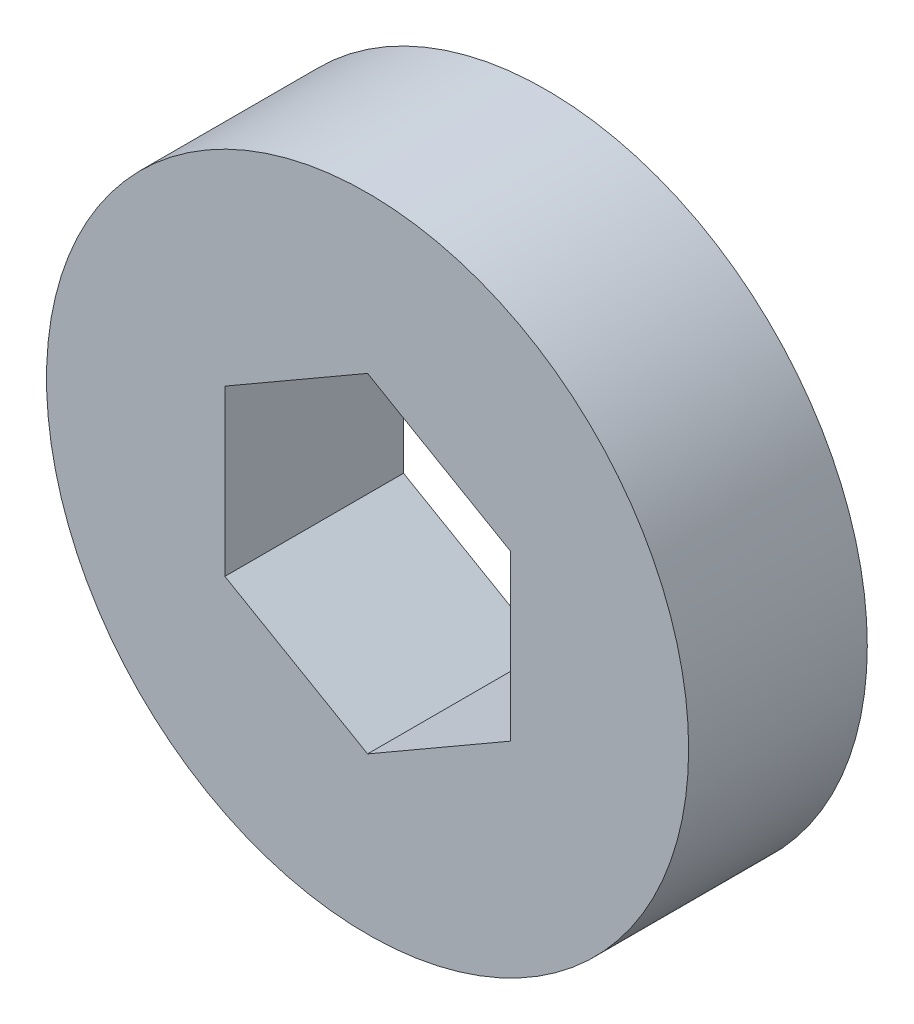
from build123d import *

# Parameters (mm, degrees)
SKETCH1_R           = 14.2875
BOSS_EXTRUDE1_DEPTH = 7.9502


with BuildPart() as part:
    # Sketch1 → Boss-Extrude1 (new body)
    with BuildSketch(Plane(origin=(0, 0, 0), x_dir=(0, 1, 0), z_dir=(0, 0, 1))):
        with Locations(Location((0, 0, 0), (0, 0, 270))):
            Circle(SKETCH1_R)
        Polygon((3.666174209, 6.35), (-3.666174209, 6.35), (-7.332348419, 0), (-3.666174209, -6.35), (3.666174209, -6.35), (7.332348419, 0), align=None, mode=Mode.SUBTRACT)
    extrude(amount=BOSS_EXTRUDE1_DEPTH)


solid = part.part
